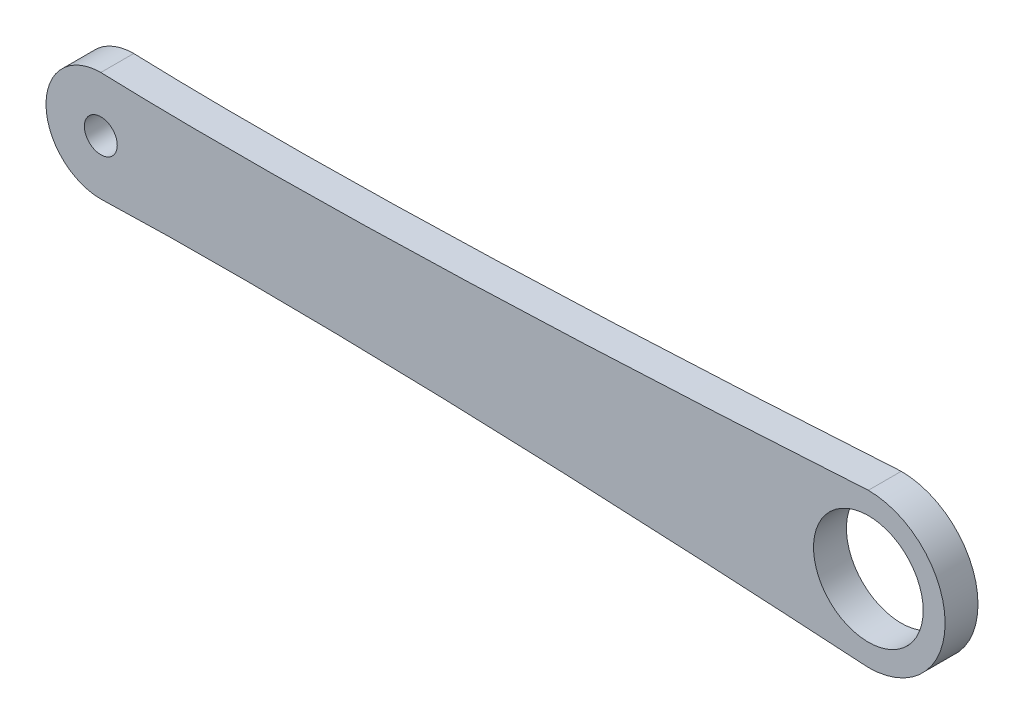
from build123d import *

# Parameters (mm, degrees)
SKETCH_1_R      = 5
SKETCH_1_R_2    = 1.5
EXTRUDE_2_DEPTH = 3


with BuildPart() as part:
    # 草图1 → 凸台-拉伸2 (new body)
    with BuildSketch(Plane.XY):
        with BuildLine():
            ThreePointArc((0, 5), (-5, 0), (0, -5))
            add(Edge.make_bspline(
                [(0, -5), (24.095302235, -4.17152905), (70, -7)],
                knots=[0, 0, 0, 1, 1, 1], degree=2))
            ThreePointArc((70, -7), (77, 0), (70, 7))
            add(Edge.make_bspline(
                [(0, 5), (24.095302235, 4.17152905), (70, 7)],
                knots=[0, 0, 0, 1, 1, 1], degree=2))
        make_face()
        with Locations((70, 0)):
            Circle(SKETCH_1_R, mode=Mode.SUBTRACT)
        Circle(SKETCH_1_R_2, mode=Mode.SUBTRACT)
    extrude(amount=EXTRUDE_2_DEPTH)


solid = part.part
